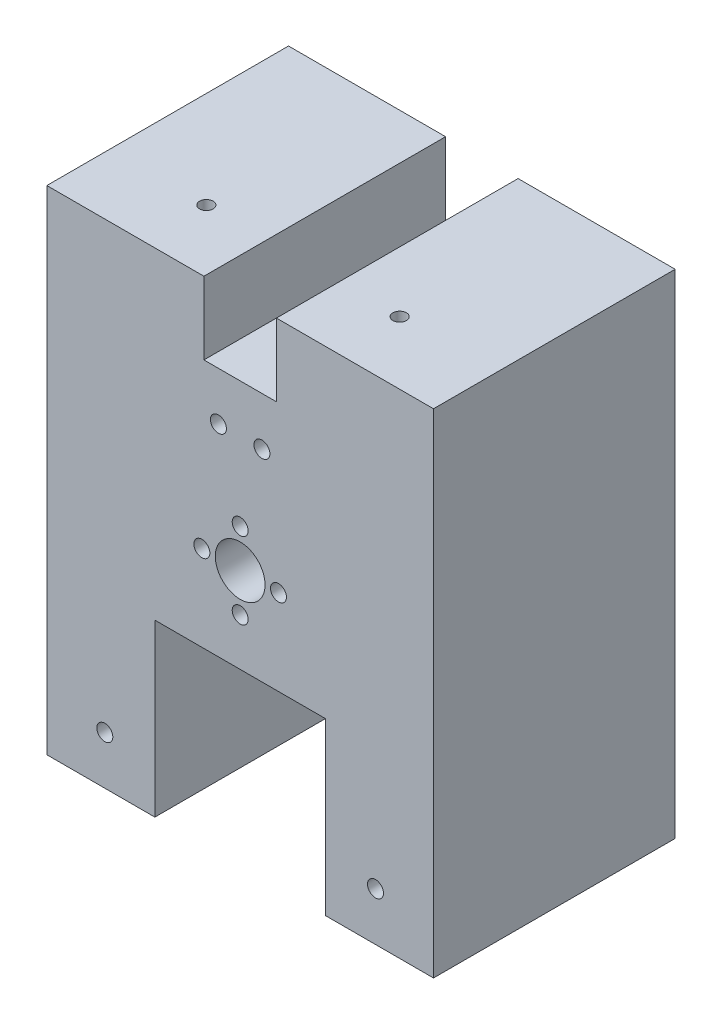
from build123d import *

# Parameters (mm, degrees)
SKETCH_1_W           = 80
SKETCH_1_H           = 103.5
EXTRUDE_1_DEPTH      = 50
SKETCH_5_R           = 1.65
CUT_EXTRUDE_4_DEPTH  = 60
SKETCH_7_W           = 15
SKETCH_7_H           = 15
CUT_EXTRUDE_6_DEPTH  = 100
SKETCH_8_R           = 1.65
CUT_EXTRUDE_7_DEPTH  = 100
SKETCH_9_R           = 5.15
CUT_EXTRUDE_8_DEPTH  = 1000
SKETCH_10_W          = 80
SKETCH_10_H          = 1.5
CUT_EXTRUDE_9_DEPTH  = 10000
SKETCH_11_W          = 35.3
SKETCH_11_H          = 35.3
CUT_EXTRUDE_10_DEPTH = 1000
SKETCH_12_R          = 1.65
CUT_EXTRUDE_11_DEPTH = 1000
SKETCH_14_R          = 1.4
CUT_EXTRUDE_12_DEPTH = 35


with BuildPart() as part:
    # 草图1 → 凸台-拉伸1 (new body)
    with BuildSketch(Plane.XY):
        Rectangle(SKETCH_1_W, SKETCH_1_H)
    extrude(amount=EXTRUDE_1_DEPTH)

    # 草图5 → 切除-拉伸4 (cut)
    with BuildSketch(Plane.XY.offset(50)):
        with Locations((7.925, 2.75)):
            Circle(SKETCH_5_R)
        with Locations((-7.925, 2.75)):
            Circle(SKETCH_5_R)
        with Locations((0, 10.675)):
            Circle(SKETCH_5_R)
        with Locations((0, -5.175)):
            Circle(SKETCH_5_R)
    extrude(amount=-CUT_EXTRUDE_4_DEPTH, mode=Mode.SUBTRACT)

    # 草图7 → 切除-拉伸6 (cut)
    with BuildSketch(Plane.XY.offset(50)):
        with Locations((0, 44.25)):
            Rectangle(SKETCH_7_W, SKETCH_7_H)
    extrude(amount=-CUT_EXTRUDE_6_DEPTH, mode=Mode.SUBTRACT)

    # 草图8 → 切除-拉伸7 (cut)
    with BuildSketch(Plane.XY.offset(50)):
        with Locations((4.5, 26.75)):
            Circle(SKETCH_8_R)
        with Locations((-4.5, 26.75)):
            Circle(SKETCH_8_R)
    extrude(amount=-CUT_EXTRUDE_7_DEPTH, mode=Mode.SUBTRACT)

    # 草图9 → 切除-拉伸8 (cut)
    with BuildSketch(Plane.XY.offset(50)):
        with Locations((0, 2.75)):
            Circle(SKETCH_9_R)
    extrude(amount=-CUT_EXTRUDE_8_DEPTH, mode=Mode.SUBTRACT)

    # 草图10 → 切除-拉伸9 (cut)
    with BuildSketch(Plane.XY.offset(50)):
        with Locations((0, -51)):
            Rectangle(SKETCH_10_W, SKETCH_10_H)
    extrude(amount=-CUT_EXTRUDE_9_DEPTH, mode=Mode.SUBTRACT)

    # 草图11 → 切除-拉伸10 (cut)
    with BuildSketch(Plane.XY.offset(50)):
        with Locations((0, -32.6)):
            Rectangle(SKETCH_11_W, SKETCH_11_H)
    extrude(amount=-CUT_EXTRUDE_10_DEPTH, mode=Mode.SUBTRACT)

    # 草图12 → 切除-拉伸11 (cut)
    with BuildSketch(Plane.XY.offset(50)):
        with Locations((28, -40.25)):
            Circle(SKETCH_12_R)
        with Locations((-28, -40.25)):
            Circle(SKETCH_12_R)
    extrude(amount=-CUT_EXTRUDE_11_DEPTH, mode=Mode.SUBTRACT)

    # 草图14 → 切除-拉伸12 (cut)
    with BuildSketch(Plane(origin=(0, 51.75, 0), x_dir=(1, 0, 0), z_dir=(0, 1, 0))):
        with Locations(Location((20, -37, 0), (0, 0, 270))):
            Circle(SKETCH_14_R)
        with Locations(Location((-20, -37, 0), (0, 0, 270))):
            Circle(SKETCH_14_R)
    extrude(amount=-CUT_EXTRUDE_12_DEPTH, mode=Mode.SUBTRACT)


solid = part.part
